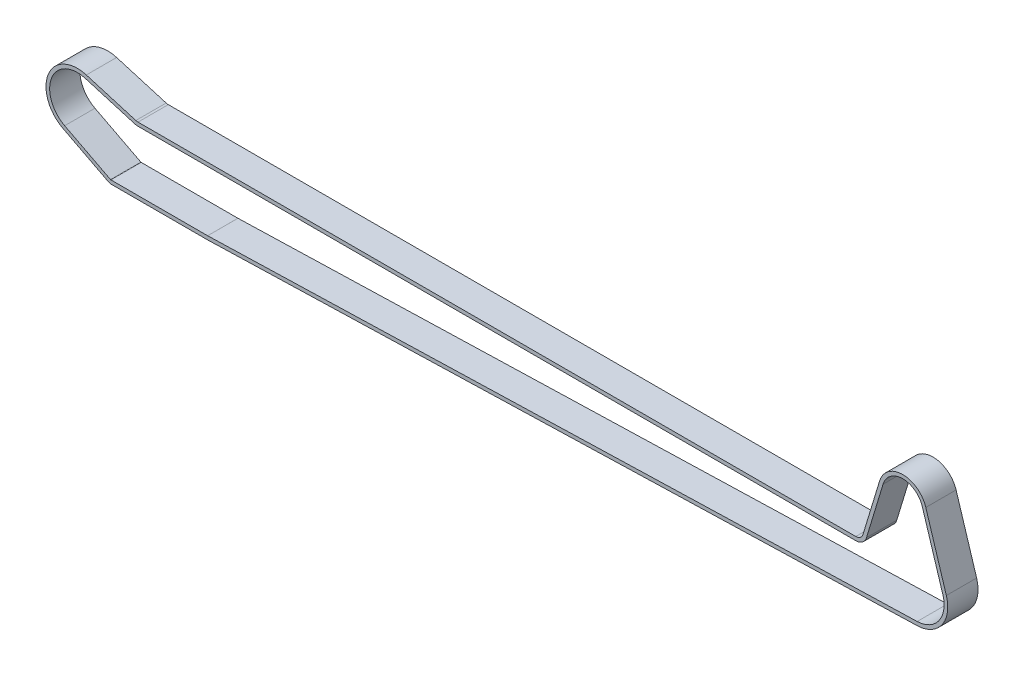
from build123d import *

# Parameters (mm, degrees)
EXTRUDE_1_DEPTH = 5
FILLET_1_R      = 0.3
FILLET_2_R      = 1.5


with BuildPart() as part:
    # 草图1 → 凸台-拉伸1 (new, symmetric)
    with BuildSketch(Plane.XY):
        with BuildLine():
            Line((141.619460126, 24.871545359), (148.401478886, 3.081820222))
            ThreePointArc((148.401478886, 3.081820222), (146.940254144, -6.024865973), (138.802378413, -10.365590543))
            Line((138.802378413, -10.365590543), (-95.482500904, -17.2))
            Line((-95.482500904, -17.2), (-127.791520657, -17.2))
            Line((-127.791520657, -17.2), (-143.257666119, -9.214201707))
            ThreePointArc((-143.257666119, -9.214201707), (-148.121840336, 3.867439534), (-135.557264597, 9.943701944))
            Line((-135.557264597, 9.943701944), (-119.199434765, 5.102771952))
            ThreePointArc((-119.199434765, 5.102771952), (-118.848420061, 5.025826388), (-118.49, 5))
            Line((-118.49, 5), (118.49, 5))
            ThreePointArc((118.49, 5), (119.978829003, 5.491670296), (120.882047608, 6.773289439))
            Line((120.882047608, 6.773289439), (126.364584034, 24.819660109))
            ThreePointArc((126.364584034, 24.819660109), (133.97285839, 30.479953843), (141.619460126, 24.871545359))
        make_face()
        with BuildLine():
            Line((-135.897793284, 8.793032481), (-119.539963452, 3.952102489))
            ThreePointArc((-119.539963452, 3.952102489), (-119.02046169, 3.838223055), (-118.49, 3.8))
            Line((-118.49, 3.8), (118.49, 3.8))
            ThreePointArc((118.49, 3.8), (120.693466924, 4.527672038), (122.030230461, 6.42446837))
            Line((122.030230461, 6.42446837), (127.512766886, 24.47083904))
            ThreePointArc((127.512766886, 24.47083904), (133.976939835, 29.279960784), (140.473676648, 24.514921996))
            Line((140.473676648, 24.514921996), (147.255695408, 2.725196859))
            ThreePointArc((147.255695408, 2.725196859), (145.963561282, -5.327678011), (138.767387661, -9.166100798))
            Line((138.767387661, -9.166100798), (-95.5, -16))
            Line((-95.5, -16), (-127.5, -16))
            Line((-127.5, -16), (-142.70711652, -8.147948858))
            ThreePointArc((-142.70711652, -8.147948858), (-147.008416189, 3.419905548), (-135.897793284, 8.793032481))
        make_face(mode=Mode.SUBTRACT)
    extrude(amount=EXTRUDE_1_DEPTH, both=True)

    # 圆角1
    fillet_1_edges = [part.edges().sort_by_distance(p)[0] for p in [
        (-127.5, -16, 0),
        (-95.5, -16, 0),
    ]]
    fillet(fillet_1_edges, radius=FILLET_1_R)

    # 圆角2
    fillet_2_edges = [part.edges().sort_by_distance(p)[0] for p in [
        (-95.482500904, -17.2, 0),
        (-127.791520657, -17.2, 0),
    ]]
    fillet(fillet_2_edges, radius=FILLET_2_R)


solid = part.part
